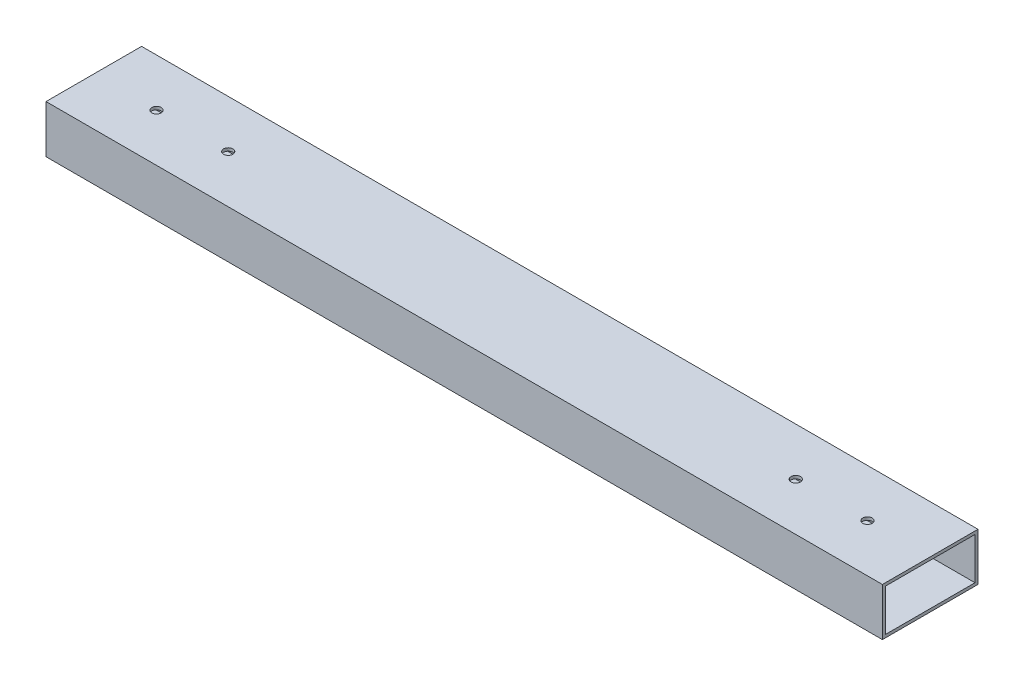
from build123d import *

# Parameters (mm, degrees)
BOSS_EXTRUDE1_DEPTH      = 222.25
BOSS_EXTRUDE1_DEPTH_BACK = 222.25
SKETCH2_W                = 50.8
SKETCH2_H                = 25.4
SKETCH2_W_2              = 47.625
SKETCH2_H_2              = 22.225
SKETCH4_R                = 2.4892
CUT_EXTRUDE2_DEPTH       = 352.780830205


with BuildPart() as part:
    # Sketch2 → Boss-Extrude1 (new, two sides: drawn at the far end of the back side and taken through both)
    with BuildSketch(Plane(origin=(0, 0, 0), x_dir=(0, 0, -1), z_dir=(1, 0, 0)).offset(-BOSS_EXTRUDE1_DEPTH_BACK)):
        with Locations((215.9, 114.3)):
            Rectangle(SKETCH2_W, SKETCH2_H)
        with Locations((215.9, 114.3)):
            Rectangle(SKETCH2_W_2, SKETCH2_H_2, mode=Mode.SUBTRACT)
    extrude(amount=BOSS_EXTRUDE1_DEPTH + BOSS_EXTRUDE1_DEPTH_BACK)

    # Sketch4 → Cut-Extrude2 (cut, through all)
    with BuildSketch(Plane(origin=(0, 0, 0), x_dir=(1, 0, 0), z_dir=(0, 1, 0))):
        with Locations(Location((150.8125, 215.9, 0), (0, 0, 270))):
            Circle(SKETCH4_R)
        with Locations(Location((188.9125, 215.9, 0), (0, 0, 270))):
            Circle(SKETCH4_R)
    cut_extrude2 = extrude(amount=CUT_EXTRUDE2_DEPTH, mode=Mode.SUBTRACT)

    # Mirror2: Cut-Extrude2 across plane
    add(cut_extrude2.mirror(Plane(origin=(0, 0, 0), x_dir=(0, 0, 1), z_dir=(1, 0, 0))), mode=Mode.SUBTRACT)


solid = part.part
